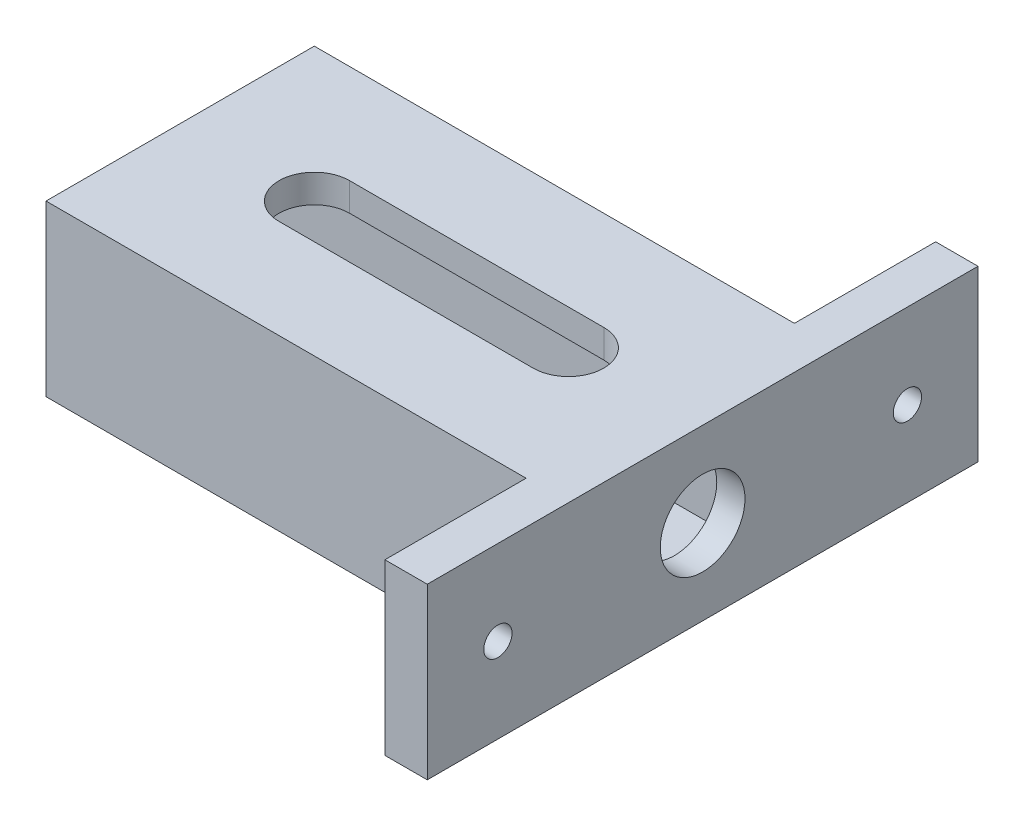
from build123d import *

# Parameters (mm, degrees)
CROQUIS1_W              = 35
CROQUIS1_H              = 15
SALIENTE_EXTRUIR1_DEPTH = 2
SALIENTE_EXTRUIR2_DEPTH = 10
CROQUIS2_W              = 37
CROQUIS2_H              = 19
SALIENTE_EXTRUIR3_DEPTH = 2
CORTAR_EXTRUIR4_DEPTH   = 3
CROQUIS8_W              = 3
CROQUIS8_H              = 12
SALIENTE_EXTRUIR5_DEPTH = 10
CROQUIS9_R              = 1
CORTAR_EXTRUIR5_DEPTH   = 10
CROQUIS10_W             = 3.25
CROQUIS10_H             = 8
SALIENTE_EXTRUIR6_DEPTH = 35
CROQUIS11_R             = 3
CORTAR_EXTRUIR6_DEPTH   = 35
CROQUIS12_R             = 1.25
CORTAR_EXTRUIR7_DEPTH   = 5


with BuildPart() as part:
    # Croquis1 → Saliente-Extruir1 (new body)
    with BuildSketch(Plane(origin=(0, 0, 0), x_dir=(1, 0, 0), z_dir=(0, 1, 0))):
        with Locations((-1, 0)):
            Rectangle(CROQUIS1_W, CROQUIS1_H)
    extrude(amount=SALIENTE_EXTRUIR1_DEPTH)

    # Croquis1<4> → Saliente-Extruir2 (add)
    with BuildSketch(Plane(origin=(0, 0, 0), x_dir=(1, 0, 0), z_dir=(0, 1, 0))):
        Polygon((16.5, -7.5), (-16.5, -7.5), (-18.5, -7.5), (-18.5, -9.5), (18.5, -9.5), (18.5, 9.5), (-18.5, 9.5), (-18.5, 7.5), (-16.5, 7.5), (16.5, 7.5), align=None)
    extrude(amount=SALIENTE_EXTRUIR2_DEPTH)

    # Croquis2 → Saliente-Extruir3 (add)
    with BuildSketch(Plane(origin=(0, 10, 0), x_dir=(1, 0, 0), z_dir=(0, 1, 0))):
        Rectangle(CROQUIS2_W, CROQUIS2_H)
    extrude(amount=SALIENTE_EXTRUIR3_DEPTH)

    # Croquis7 → Cortar-Extruir4 (cut)
    with BuildSketch(Plane(origin=(0, 12, 0), x_dir=(1, 0, 0), z_dir=(0, 1, 0))):
        with BuildLine():
            Line((9, 2.5), (-9, 2.5))
            ThreePointArc((-9, 2.5), (-11.5, 0), (-9, -2.5))
            Line((-9, -2.5), (9, -2.5))
            ThreePointArc((9, -2.5), (11.5, 0), (9, 2.5))
        make_face()
    extrude(amount=-CORTAR_EXTRUIR4_DEPTH, mode=Mode.SUBTRACT)

    # Croquis8 → Saliente-Extruir5 (add)
    with BuildSketch(Plane(origin=(0, 0, -9.5), x_dir=(-1, 0, 0), z_dir=(0, 0, -1))):
        with Locations((-17, 6)):
            Rectangle(CROQUIS8_W, CROQUIS8_H)
    saliente_extruir5 = extrude(amount=SALIENTE_EXTRUIR5_DEPTH)

    # Croquis9 → Cortar-Extruir5 (cut)
    with BuildSketch(Plane.ZY.offset(-15.5)):
        with Locations((-14.5, 6)):
            Circle(CROQUIS9_R)
    cortar_extruir5 = extrude(amount=-CORTAR_EXTRUIR5_DEPTH, mode=Mode.SUBTRACT)

    # Simetría3: Saliente-Extruir5, Cortar-Extruir5 across plane
    add(saliente_extruir5.mirror(Plane.XY))
    add(cortar_extruir5.mirror(Plane.XY), mode=Mode.SUBTRACT)

    # Croquis10 → Saliente-Extruir6 (add)
    with BuildSketch(Plane.ZY.offset(-16.5)):
        with Locations((-5.875, 6)):
            Rectangle(CROQUIS10_W, CROQUIS10_H)
        with Locations((5.875, 6)):
            Rectangle(CROQUIS10_W, CROQUIS10_H)
    extrude(amount=SALIENTE_EXTRUIR6_DEPTH)

    # Croquis11 → Cortar-Extruir6 (cut)
    with BuildSketch(Plane(origin=(18.5, 0, 0), x_dir=(0, 0, -1), z_dir=(1, 0, 0))):
        with Locations((0, 6)):
            Circle(CROQUIS11_R)
    extrude(amount=-CORTAR_EXTRUIR6_DEPTH, mode=Mode.SUBTRACT)

    # Croquis12 → Cortar-Extruir7 (cut)
    with BuildSketch(Plane.XZ):
        with Locations((-8.5, 0)):
            Circle(CROQUIS12_R)
    extrude(amount=-CORTAR_EXTRUIR7_DEPTH, mode=Mode.SUBTRACT)


solid = part.part
